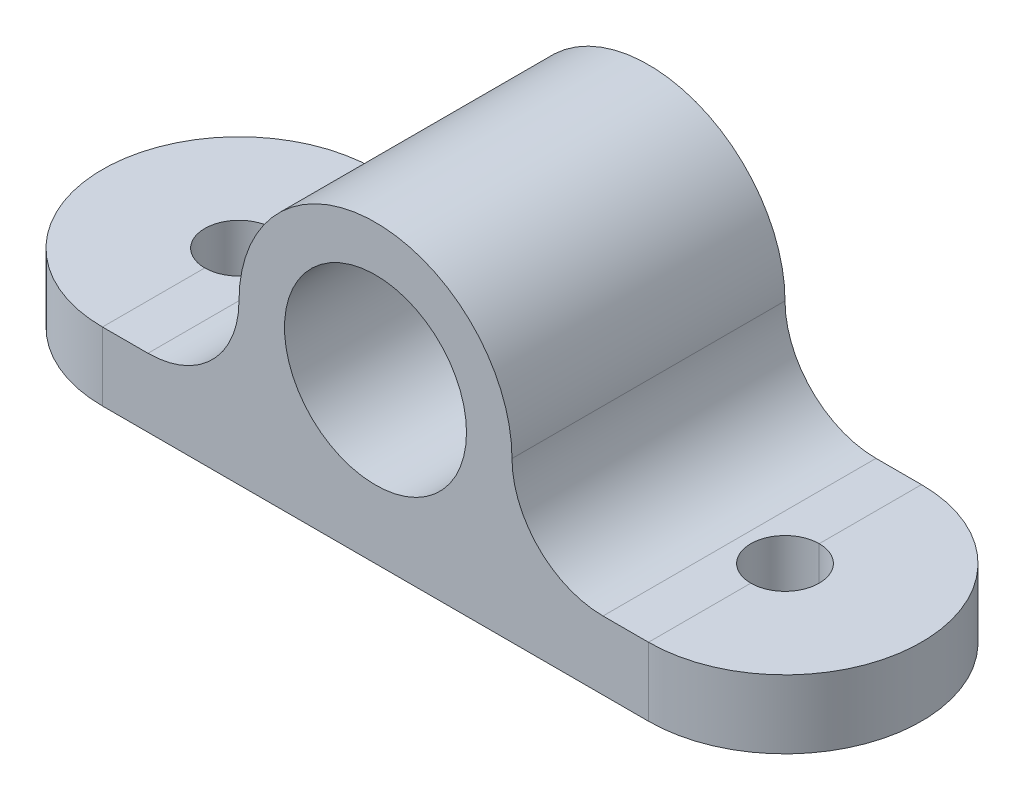
from build123d import *

# Parameters (mm, degrees)
BOSS_EXTRUDE1_DEPTH   = 19.05
SKETCH1_3_R           = 6.35
CUT_EXTRUDE1_DEPTH    = 22.5044
BOSS_EXTRUDE2_DEPTH   = 4.7752
BOSS_EXTRUDE2_2_DEPTH = 4.7752
SKETCH3_R             = 2.3876
CUT_EXTRUDE2_DEPTH    = 54.686617934
FILLET1_R             = 6.35
FILLET2_R             = 6.35


with BuildPart() as part:
    # Sketch1 → Boss-Extrude1 (new body)
    with BuildSketch(Plane.XY):
        with BuildLine():
            Line((28.575, 4.7752), (28.575, 11.0998))
            ThreePointArc((28.575, 11.0998), (19.05, 20.6248), (9.525, 11.0998))
            Line((9.525, 11.0998), (9.525, 4.7752))
            Line((9.525, 4.7752), (0, 4.7752))
            Line((0, 4.7752), (0, 0))
            Line((0, 0), (38.1, 0))
            Line((38.1, 0), (38.1, 4.7752))
            Line((38.1, 4.7752), (28.575, 4.7752))
        make_face()
        with BuildLine():
            ThreePointArc((19.617393021, 4.7752), (19.05, 4.7498), (18.482606979, 4.7752))
            Line((18.482606979, 4.7752), (19.617393021, 4.7752))
        make_face(mode=Mode.SUBTRACT)
    extrude(amount=BOSS_EXTRUDE1_DEPTH)

    # Sketch1<3> → Cut-Extrude1 (cut)
    with BuildSketch(Plane.XY):
        with Locations((19.05, 11.0998)):
            Circle(SKETCH1_3_R)
    extrude(amount=CUT_EXTRUDE1_DEPTH, mode=Mode.SUBTRACT)


with BuildPart() as body_2:
    # Sketch2 → Boss-Extrude2 (new body)
    with BuildSketch(Plane(origin=(0, 4.7752, 0), x_dir=(1, 0, 0), z_dir=(0, 1, 0))):
        with BuildLine():
            Line((38.1, 0), (38.1, -19.05))
            ThreePointArc((38.1, -19.05), (47.625, -9.525), (38.1, 0))
        make_face()
    extrude(amount=-BOSS_EXTRUDE2_DEPTH)


with BuildPart() as body_3:
    # Sketch2 → Boss-Extrude2 2 (new body)
    with BuildSketch(Plane(origin=(0, 4.7752, 0), x_dir=(1, 0, 0), z_dir=(0, 1, 0))):
        with BuildLine():
            Line((0, 0), (0, -19.05))
            ThreePointArc((0, -19.05), (-9.525, -9.525), (0, 0))
        make_face()
    extrude(amount=-BOSS_EXTRUDE2_2_DEPTH)


with BuildPart() as cut_extrude2_tool:
    # Sketch3 → Cut-Extrude2 (new, through all)
    with BuildSketch(Plane(origin=(0, 4.7752, 0), x_dir=(1, 0, 0), z_dir=(0, 1, 0))):
        with Locations((38.1, -9.525)):
            Circle(SKETCH3_R)
        with Locations((0, -9.525)):
            Circle(SKETCH3_R)
    extrude(amount=-CUT_EXTRUDE2_DEPTH)


with BuildPart() as part_1:
    add(part.part)

    # Cut-Extrude2: cut by cut_extrude2_tool
    add(cut_extrude2_tool.part, mode=Mode.SUBTRACT)

    # Fillet1
    fillet1_edges = [part_1.edges().sort_by_distance(p)[0] for p in [
        (28.575, 4.7752, 9.525),
    ]]
    fillet(fillet1_edges, radius=FILLET1_R)

    # Fillet2
    fillet2_edges = [part_1.edges().sort_by_distance(p)[0] for p in [
        (9.525, 4.7752, 9.525),
    ]]
    fillet(fillet2_edges, radius=FILLET2_R)


with BuildPart() as body_2_1:
    add(body_2.part)

    # Cut-Extrude2: cut by cut_extrude2_tool
    add(cut_extrude2_tool.part, mode=Mode.SUBTRACT)


with BuildPart() as body_3_1:
    add(body_3.part)

    # Cut-Extrude2: cut by cut_extrude2_tool
    add(cut_extrude2_tool.part, mode=Mode.SUBTRACT)


solid = Compound([part_1.part, body_2_1.part, body_3_1.part])
